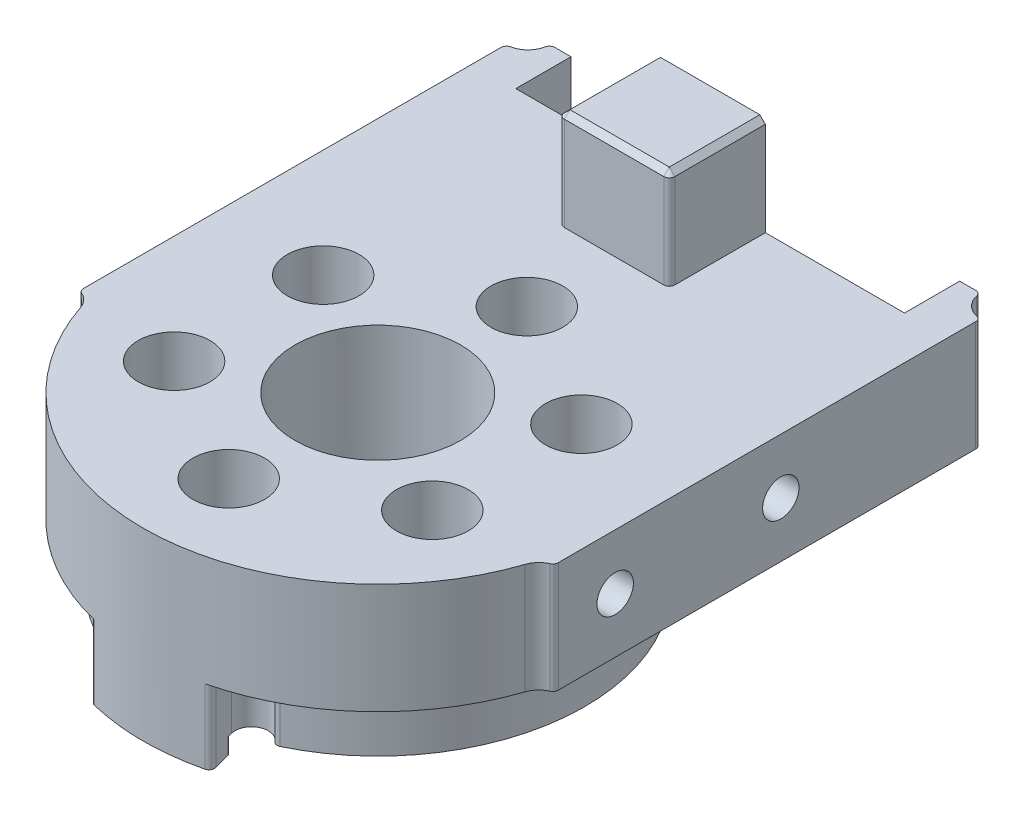
from build123d import *

# Parameters (mm, degrees)
EXTRUDE_1_DEPTH              = 10
SKETCH_2_W                   = 43
SKETCH_2_H                   = 10
EXTRUDE_2_DEPTH              = 24.24999999999997
EXTRUDE_3_DEPTH              = 6.6999999999999975
CUT_EXTRUDE_START            = -1.449999999999993
CUT_EXTRUDE_1_DEPTH          = 1.449999999999993
EXTRUDE_4_DEPTH              = 16.349999999999994
SKETCH_6_W                   = 35.2
SKETCH_6_H                   = 8.099999999999994
CUT_EXTRUDE_2_DEPTH          = 5
SKETCH_7_W                   = 9.999999999999998
SKETCH_7_H                   = 8.7
EXTRUDE_5_DEPTH              = 8.999999999999995
HOLE_WIZARD_3_3_3_3_1_D      = 3.3
HOLE_WIZARD_3_3_3_3_1_DEPTH  = 8.5
HOLE_WIZARD_3_3_3_3_1_TIP    = 0.9914200213954745
HOLE_WIZARD_3_3_3_3_2_D      = 3.3
HOLE_WIZARD_3_3_3_3_2_DEPTH  = 8.5
HOLE_WIZARD_3_3_3_3_2_TIP    = 0.9914200213954745
HOLE_WIZARD_3_3_3_3_3_D      = 3.3
HOLE_WIZARD_3_3_3_3_3_DEPTH  = 9
HOLE_WIZARD_3_3_3_3_3_TIP    = 0.9914200213954745
HOLE_WIZARD_15_0_15_1_D      = 15
HOLE_WIZARD_15_0_15_1_DEPTH  = 24.25
HOLE_WIZARD_M3_1_D           = 3.4
HOLE_WIZARD_M3_1_DEPTH       = 16.7
HOLE_WIZARD_M3_1_CBORE_D     = 6.5
HOLE_WIZARD_M3_1_CBORE_DEPTH = 4.75
HOLE_WIZARD_4_0_4_1_D        = 4
HOLE_WIZARD_4_0_4_1_DEPTH    = 16.7
FILLET_1_R                   = 0.5
CHAMFER_1_SIZE               = 0.4999999999999948
FILLET_2_R                   = 2


with BuildPart() as part:
    # 草图1 → 凸台-拉伸1 (new body)
    with BuildSketch(Plane(origin=(0, -51, 0), x_dir=(1, 0, 0), z_dir=(0, 1, 0))):
        with BuildLine():
            Line((21.5, -35.60000000000002), (-21.5, -35.59999999999997))
            ThreePointArc((-21.5, -35.59999999999997), (-20.657569635687853, -36.07468782040316), (-20.1362960848869, -36.8891148157745))
            ThreePointArc((-20.1362960848869, -36.8891148157745), (-3.42e-15, -51.35000000000001), (20.1362960848869, -36.8891148157745))
            ThreePointArc((20.1362960848869, -36.8891148157745), (20.65756963568787, -36.07468782040319), (21.5, -35.60000000000002))
        make_face()
    extrude(amount=-EXTRUDE_1_DEPTH)

    # 草图2 → 凸台-拉伸2 (add)
    with BuildSketch(Plane(origin=(-4.021e-14, 0, 35.599999999999994), x_dir=(-1, 0, -1.13e-15), z_dir=(1.13e-15, 0, -1))):
        with Locations((-4.086e-14, -56.00000000000001)):
            Rectangle(SKETCH_2_W, SKETCH_2_H)
    extrude(amount=EXTRUDE_2_DEPTH)

    # 草图3 → 凸台-拉伸3 (add)
    with BuildSketch(Plane.XZ.offset(61)):
        with BuildLine():
            Line((-4.85285709567227, 48.211109242919996), (-5.499904708428581, 50.625923808642696))
            ThreePointArc((-5.499904708428581, 50.625923808642696), (1.3e-15, 51.349999999999994), (5.499904708428581, 50.625923808642696))
            Line((5.499904708428581, 50.625923808642696), (4.852857095672274, 48.21110924292003))
            ThreePointArc((4.852857095672274, 48.21110924292003), (5.799211712715089, 46.409565616324066), (7.6704851839498795, 47.209241860550264))
            ThreePointArc((7.6704851839498795, 47.209241860550264), (-3.02e-15, 11.349999999999994), (-7.67048518394987, 47.209241860550264))
            ThreePointArc((-7.67048518394987, 47.209241860550264), (-5.799211712715104, 46.40956561632406), (-4.85285709567227, 48.211109242919996))
        make_face()
    extrude(amount=EXTRUDE_3_DEPTH)

    # 草图4 → 切除-拉伸1 (cut)
    with BuildSketch(Plane.XZ.offset(67.7).offset(CUT_EXTRUDE_START)):
        with BuildLine():
            ThreePointArc((7.6704851839498795, 47.209241860550264), (5.799211712715057, 46.409565616324066), (4.85285709567228, 48.211109242920095))
            ThreePointArc((4.85285709567228, 48.211109242920095), (-7.18e-15, 48.850000000000065), (-4.85285709567227, 48.211109242919996))
            ThreePointArc((-4.85285709567227, 48.211109242919996), (-5.799211712715106, 46.409565616324066), (-7.67048518394987, 47.209241860550264))
            ThreePointArc((-7.67048518394987, 47.209241860550264), (-3.44e-15, 11.349999999999998), (7.6704851839498795, 47.209241860550264))
        make_face()
    extrude(amount=CUT_EXTRUDE_1_DEPTH, mode=Mode.SUBTRACT)

    # 草图5 → 凸台-拉伸4 (add)
    with BuildSketch(Plane(origin=(-1.282e-14, 0, 11.35000000000002), x_dir=(-1, 0, -1.13e-15), z_dir=(1.13e-15, 0, -1))):
        Polygon((21.499999999999986, -51), (21.499999999999986, -61), (-21.500000000000007, -61), (-21.50000000000001, -51), align=None)
    extrude(amount=EXTRUDE_4_DEPTH)

    # 草图6 → 切除-拉伸2 (cut)
    with BuildSketch(Plane(origin=(5.65e-15, 0, -4.999999999999973), x_dir=(-1, 0, -1.13e-15), z_dir=(1.13e-15, 0, -1))):
        with Locations((7.11e-15, -55.050000000000004)):
            Rectangle(SKETCH_6_W, SKETCH_6_H)
    extrude(amount=-CUT_EXTRUDE_2_DEPTH, mode=Mode.SUBTRACT)

    # 草图7 → 凸台-拉伸5 (add)
    with BuildSketch(Plane(origin=(0, -51, 0), x_dir=(-1, 0, 0), z_dir=(0, 1, 0))):
        with Locations((-8.9e-16, 4.35)):
            Rectangle(SKETCH_7_W, SKETCH_7_H)
    extrude(amount=EXTRUDE_5_DEPTH)

    # Ø3.3 (3.3) 直径孔1
    with Locations(Plane(origin=(21.50000000000004, 0, 2.429e-14), x_dir=(1.13e-15, 0, -1), z_dir=(1, 0, 1.13e-15))):
        with Locations((-15.1, -56), (-30.1, -56)):
            Hole(HOLE_WIZARD_3_3_3_3_1_D / 2, depth=HOLE_WIZARD_3_3_3_3_1_DEPTH)
            with Locations((0, 0, -(HOLE_WIZARD_3_3_3_3_1_DEPTH + HOLE_WIZARD_3_3_3_3_1_TIP / 2))):  # 118° drill point
                Cone(0, HOLE_WIZARD_3_3_3_3_1_D / 2, HOLE_WIZARD_3_3_3_3_1_TIP, mode=Mode.SUBTRACT)

    # Ø3.3 (3.3) 直径孔2
    with Locations(Plane.ZY.offset(21.499999999999957)):
        with Locations((15.1, -56), (30.1, -56)):
            Hole(HOLE_WIZARD_3_3_3_3_2_D / 2, depth=HOLE_WIZARD_3_3_3_3_2_DEPTH)
            with Locations((0, 0, -(HOLE_WIZARD_3_3_3_3_2_DEPTH + HOLE_WIZARD_3_3_3_3_2_TIP / 2))):  # 118° drill point
                Cone(0, HOLE_WIZARD_3_3_3_3_2_D / 2, HOLE_WIZARD_3_3_3_3_2_TIP, mode=Mode.SUBTRACT)

    # Ø3.3 (3.3) 直径孔3
    with Locations(Plane(origin=(0, 0, 0), x_dir=(-1, 0, -1.13e-15), z_dir=(1.13e-15, 0, -1))):
        with Locations((-9.5, -55), (9.5, -55)):
            Hole(HOLE_WIZARD_3_3_3_3_3_D / 2, depth=HOLE_WIZARD_3_3_3_3_3_DEPTH)
            with Locations((0, 0, -(HOLE_WIZARD_3_3_3_3_3_DEPTH + HOLE_WIZARD_3_3_3_3_3_TIP / 2))):  # 118° drill point
                Cone(0, HOLE_WIZARD_3_3_3_3_3_D / 2, HOLE_WIZARD_3_3_3_3_3_TIP, mode=Mode.SUBTRACT)

    # Ø15.0 (15) 直径孔1
    with Locations(Plane.XZ.offset(66.25)):
        with Locations((0, 30.1)):
            Hole(HOLE_WIZARD_15_0_15_1_D / 2, depth=HOLE_WIZARD_15_0_15_1_DEPTH)

    # M3 六角头机械螺钉的柱形沉头孔1
    with Locations(Plane(origin=(0, -51, 0), x_dir=(1, 0, 0), z_dir=(0, 1, 0))):
        with Locations((0, -43.6), (-11.691342951, -36.85), (-11.691342951, -23.35), (0, -16.6), (11.691342951, -23.35), (11.691342951, -36.85)):
            CounterBoreHole(HOLE_WIZARD_M3_1_D / 2, HOLE_WIZARD_M3_1_CBORE_D / 2, HOLE_WIZARD_M3_1_CBORE_DEPTH, depth=HOLE_WIZARD_M3_1_DEPTH)

    # Ø4.0 (4) 直径孔1
    with Locations(Plane(origin=(0, -51, 0), x_dir=(1, 0, 0), z_dir=(0, 1, 0))):
        with Locations((21.5, 5), (-21.5, 5)):
            Hole(HOLE_WIZARD_4_0_4_1_D / 2, depth=HOLE_WIZARD_4_0_4_1_DEPTH)

    # 圆角1
    fillet_1_edges = [part.edges().sort_by_distance(p)[0] for p in [
        (-21.499999999999954, -56, -3),
        (-19.5, -56, -4.9999999999999964),
        (19.5, -56, -4.999999999999999),
        (21.500000000000043, -56, -3),
        (-4.852857095672272, -66.97500000000001, 48.211109242919996),
        (4.852857095672273, -66.97500000000001, 48.21110924292003),
        (5.499904708428581, -64.35, 50.625923808642696),
        (-5.499904708428581, -64.35, 50.625923808642696),
        (7.6704851839498795, -63.62500000000001, 47.209241860550264),
        (-7.670485183949873, -63.62500000000001, 47.209241860550264),
        (-21.5, -56, 35.59999999999997),
        (21.5, -56, 35.60000000000002),
        (-4.999999999999998, -46.5, 8.7),
        (5, -46.5, 8.7),
    ]]
    fillet(fillet_1_edges, radius=FILLET_1_R)

    # 倒角1
    chamfer_1_edges = [part.edges().sort_by_distance(p)[0] for p in [
        (5, -42.00000000000001, 4.1),
        (8.9e-16, -42.00000000000001, 8.7),
        (-4.853553390593272, -42.00000000000001, 8.553553390593272),
        (4.853553390593274, -42.00000000000001, 8.553553390593272),
        (-4.999999999999998, -42.00000000000001, 4.1),
    ]]
    chamfer(chamfer_1_edges, length=CHAMFER_1_SIZE)

    # 圆角2
    fillet_2_edges = [part.edges().sort_by_distance(p)[0] for p in [
        (-17.600000000000005, -59.1, -2.499999999999993),
        (17.599999999999998, -59.1, -2.499999999999954),
    ]]
    fillet(fillet_2_edges, radius=FILLET_2_R)


solid = part.part
